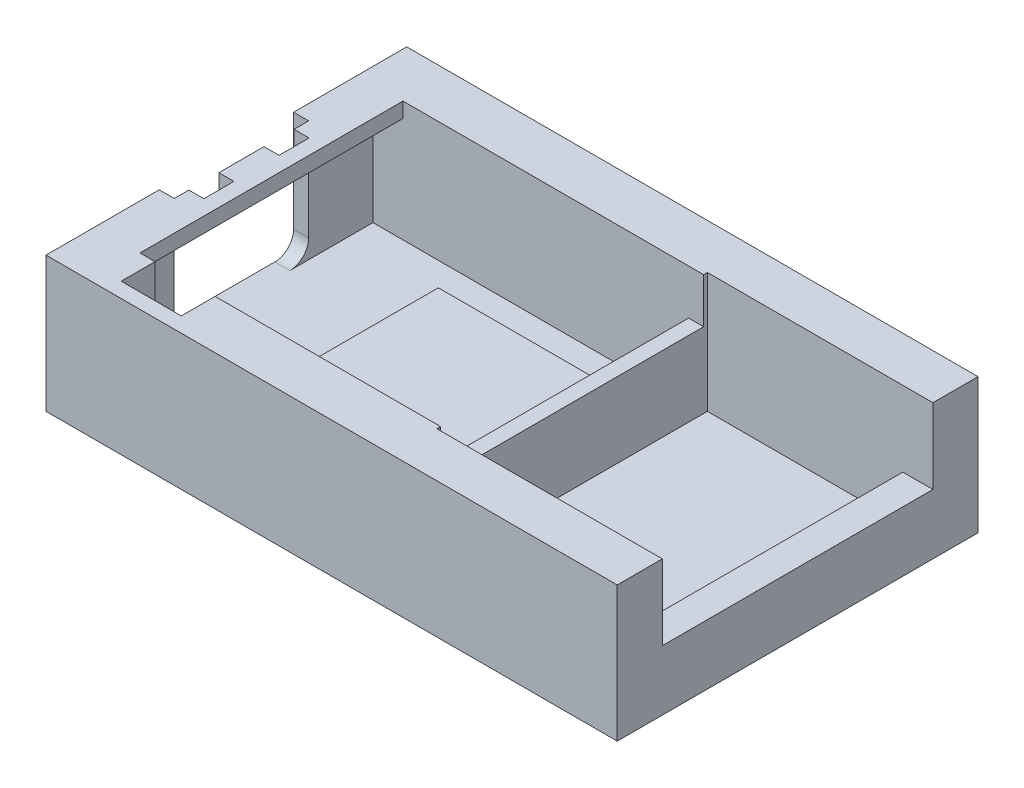
from build123d import *

# Parameters (mm, degrees)
SKETCH1_W           = 40
SKETCH1_H           = 24
BOSS_EXTRUDE1_DEPTH = 1
SKETCH2_W           = 40
SKETCH2_H           = 24
SKETCH2_W_2         = 21
SKETCH2_H_2         = 17.5
SKETCH2_W_3         = 13
SKETCH2_H_3         = 18
BOSS_EXTRUDE3_DEPTH = 8
SKETCH3_W           = 1
SKETCH3_H           = 17.5
CUT_EXTRUDE2_DEPTH  = 3
SKETCH4_W           = 10.24
SKETCH4_H           = 11.92
BOSS_EXTRUDE4_DEPTH = 1.21
CUT_EXTRUDE3_DEPTH  = 2
SKETCH8_W           = 4
SKETCH8_H           = 18
CUT_EXTRUDE4_DEPTH  = 5
SKETCH11_W          = 24
SKETCH11_H          = 9
CUT_EXTRUDE5_DEPTH  = 2
SKETCH12_W          = 4
SKETCH12_H          = 3
CUT_EXTRUDE6_DEPTH  = 3
BOSS_EXTRUDE5_DEPTH = 1


with BuildPart() as part:
    # Sketch1 → Boss-Extrude1 (new body)
    with BuildSketch(Plane(origin=(0, 0, 0), x_dir=(1, 0, 0), z_dir=(0, 1, 0))):
        with Locations((20, 12)):
            Rectangle(SKETCH1_W, SKETCH1_H)
    extrude(amount=BOSS_EXTRUDE1_DEPTH)

    # Sketch2 → Boss-Extrude3 (add)
    with BuildSketch(Plane(origin=(0, 1, 0), x_dir=(1, 0, 0), z_dir=(0, 1, 0))):
        with Locations((20, 12)):
            Rectangle(SKETCH2_W, SKETCH2_H)
        with Locations((11.5, 12)):
            Rectangle(SKETCH2_W_2, SKETCH2_H_2, mode=Mode.SUBTRACT)
        with Locations((29.5, 12)):
            Rectangle(SKETCH2_W_3, SKETCH2_H_3, mode=Mode.SUBTRACT)
    extrude(amount=BOSS_EXTRUDE3_DEPTH)

    # Sketch3 → Cut-Extrude2 (cut)
    with BuildSketch(Plane(origin=(0, 9, 0), x_dir=(1, 0, 0), z_dir=(0, 1, 0))):
        with Locations((22.5, 12)):
            Rectangle(SKETCH3_W, SKETCH3_H)
    extrude(amount=-CUT_EXTRUDE2_DEPTH, mode=Mode.SUBTRACT)

    # Sketch4 → Boss-Extrude4 (add)
    with BuildSketch(Plane(origin=(0, 1, 0), x_dir=(1, 0, 0), z_dir=(0, 1, 0))):
        with Locations((13.26, 12)):
            Rectangle(SKETCH4_W, SKETCH4_H)
    extrude(amount=BOSS_EXTRUDE4_DEPTH)

    # Sketch5 → Cut-Extrude3 (cut)
    with BuildSketch(Plane(origin=(1, 0, 0), x_dir=(0, 0, -1), z_dir=(1, 0, 0))):
        with BuildLine():
            Line((7.53, 2.25), (7.53, 2.96))
            Line((7.53, 2.96), (7.53, 9))
            Line((7.53, 9), (16.47, 9))
            Line((16.47, 9), (16.47, 2.96))
            Line((16.47, 2.96), (16.47, 2.25))
            ThreePointArc((16.47, 2.25), (16.103883476, 1.366116524), (15.22, 1))
            Line((15.22, 1), (8.78, 1))
            ThreePointArc((8.78, 1), (7.896116524, 1.366116524), (7.53, 2.25))
        make_face()
    extrude(amount=-CUT_EXTRUDE3_DEPTH, mode=Mode.SUBTRACT)

    # Sketch8 → Cut-Extrude4 (cut)
    with BuildSketch(Plane(origin=(0, 9, 0), x_dir=(1, 0, 0), z_dir=(0, 1, 0))):
        with Locations((38, 12)):
            Rectangle(SKETCH8_W, SKETCH8_H)
    extrude(amount=-CUT_EXTRUDE4_DEPTH, mode=Mode.SUBTRACT)

    # Sketch11 → Cut-Extrude5 (cut)
    with BuildSketch(Plane(origin=(40, 0, 0), x_dir=(0, 0, -1), z_dir=(1, 0, 0))):
        with Locations((12, 4.5)):
            Rectangle(SKETCH11_W, SKETCH11_H)
    extrude(amount=-CUT_EXTRUDE5_DEPTH, mode=Mode.SUBTRACT)

    # Sketch12 → Cut-Extrude6 (cut)
    with BuildSketch(Plane(origin=(0, 9, 0), x_dir=(1, 0, 0), z_dir=(0, 1, 0))):
        with Locations((6, 2.5)):
            Rectangle(SKETCH12_W, SKETCH12_H)
    extrude(amount=-CUT_EXTRUDE6_DEPTH, mode=Mode.SUBTRACT)

    # Sketch13 → Boss-Extrude5 (add)
    with BuildSketch(Plane(origin=(0, 9, 0), x_dir=(1, 0, 0), z_dir=(0, 1, 0))):
        Polygon((1, 20.75), (3, 20.75), (3, 3.25), (1, 3.25), (1, 7.53), (1, 8.5), (2, 8.5), (2, 10.5), (1, 10.5), (1, 13.5), (2, 13.5), (2, 15.5), (1, 15.5), (1, 16.47), align=None)
    extrude(amount=-BOSS_EXTRUDE5_DEPTH)


solid = part.part
